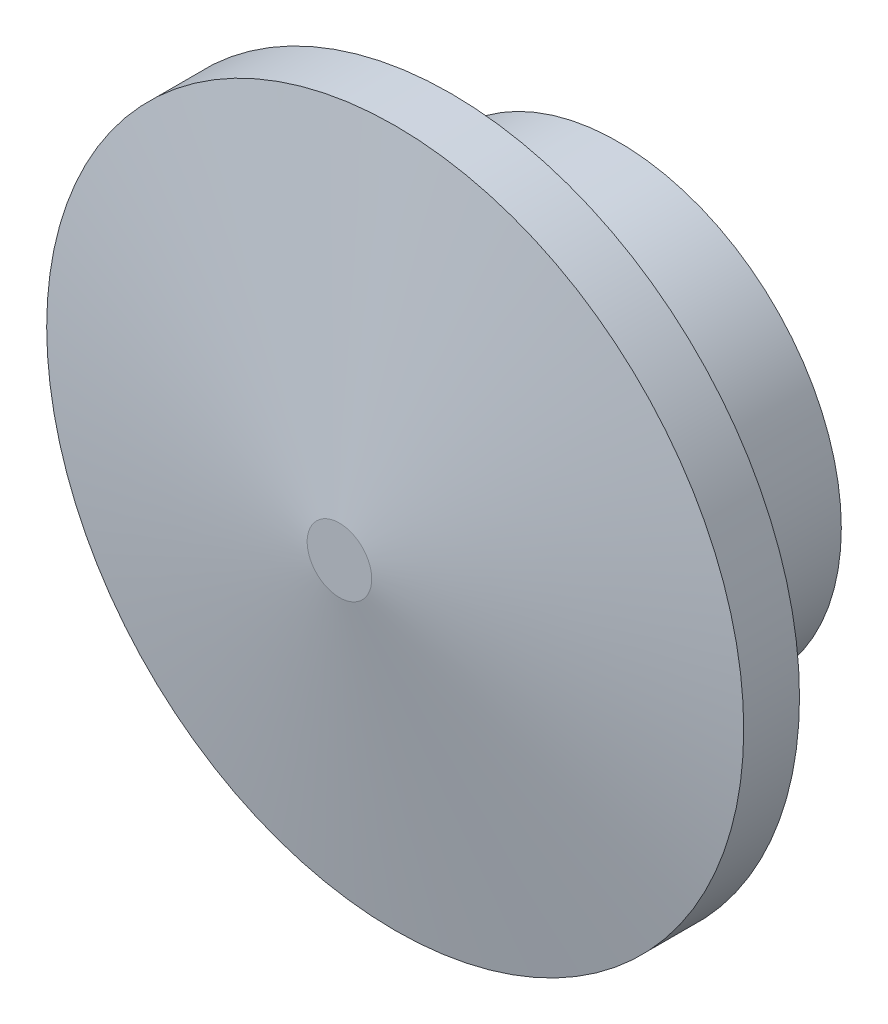
from build123d import *

# Parameters (mm, degrees)
SKETCH1_R           = 8
BOSS_EXTRUDE2_DEPTH = 6
SKETCH5_R           = 12.5
BOSS_EXTRUDE3_DEPTH = 2
SKETCH6_R           = 12.5
BOSS_EXTRUDE4_DEPTH = 2
BOSS_EXTRUDE4_TAPER = 80


with BuildPart() as part:
    # Sketch1 → Boss-Extrude2 (new body)
    with BuildSketch(Plane.XY):
        Circle(SKETCH1_R)
    extrude(amount=-BOSS_EXTRUDE2_DEPTH)

    # Sketch5 → Boss-Extrude3 (add)
    with BuildSketch(Plane.XY):
        Circle(SKETCH5_R)
    extrude(amount=BOSS_EXTRUDE3_DEPTH)

    # Sketch6 → Boss-Extrude4 (add)
    with BuildSketch(Plane.XY.offset(2)):
        Circle(SKETCH6_R)
    extrude(amount=BOSS_EXTRUDE4_DEPTH, taper=BOSS_EXTRUDE4_TAPER)


solid = part.part
